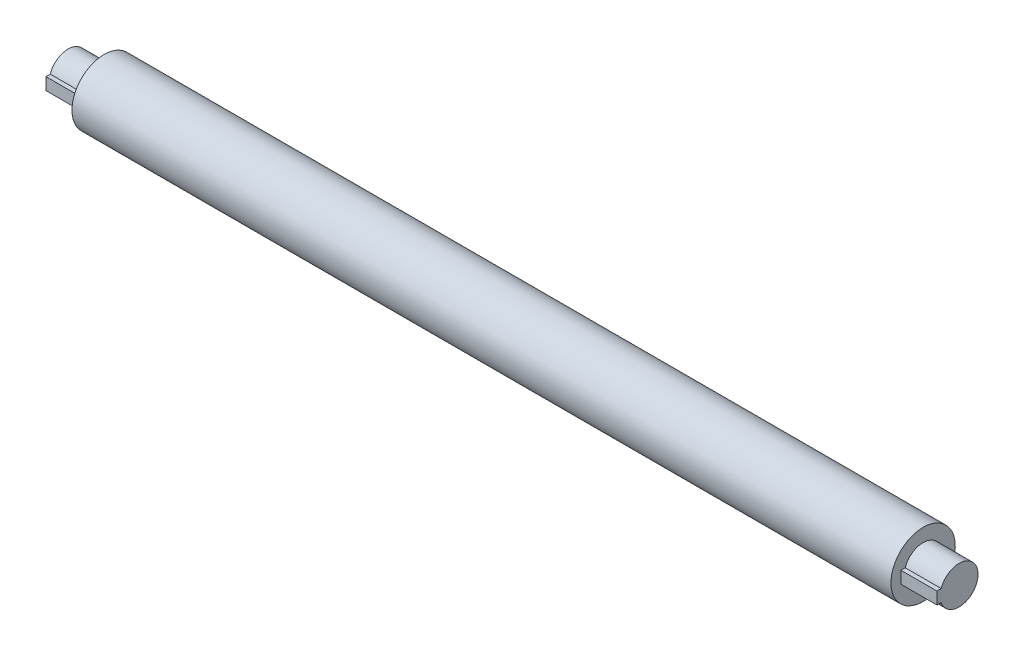
from build123d import *

# Parameters (mm, degrees)
BOSS_EXTRUDE1_REACH      = 596.549
BOSS_EXTRUDE1_END_RADIUS = 25
SKETCH3_W                = 47.52
SKETCH3_H                = 16


with BuildPart() as part:
    # Sketch1 → Revolve1 (revolve)
    with BuildSketch(Plane.XY):
        Polygon((-588.665, 0), (-588.665, 25), (-541.145, 25), (-541.145, 42.5), (541.145, 42.5), (541.145, 25), (588.665, 25), (588.665, 0), align=None)
    revolve(axis=Axis((588.665, 0, 0), (-1, 0, 0)))

    # Boss-Extrude1: up to this cylinder (the profile starts outside it)
    boss_extrude1_end = Plane(origin=(0, 0, 0), z_dir=(1, 0, 0)) * Cylinder(BOSS_EXTRUDE1_END_RADIUS, 2373.908, mode=Mode.PRIVATE)
    # Sketch3 → Boss-Extrude1 (add, up to the surface)
    with BuildSketch(Plane.XY.offset(29.3), mode=Mode.PRIVATE) as boss_extrude1_sk1:
        with Locations((-564.905, 0)):
            Rectangle(SKETCH3_W, SKETCH3_H)
    boss_extrude1_tool1 = extrude(boss_extrude1_sk1.sketch, amount=-BOSS_EXTRUDE1_REACH, mode=Mode.PRIVATE) - boss_extrude1_end
    add(boss_extrude1_tool1.solids().sort_by_distance((-564.905, 0, 29.3))[0])
    # Sketch3 → Boss-Extrude1 (add, up to the surface)
    with BuildSketch(Plane.XY.offset(29.3), mode=Mode.PRIVATE) as boss_extrude1_sk2:
        with Locations((564.905, 0)):
            Rectangle(SKETCH3_W, SKETCH3_H)
    boss_extrude1_tool2 = extrude(boss_extrude1_sk2.sketch, amount=-BOSS_EXTRUDE1_REACH, mode=Mode.PRIVATE) - boss_extrude1_end
    add(boss_extrude1_tool2.solids().sort_by_distance((564.905, 0, 29.3))[0])


solid = part.part
